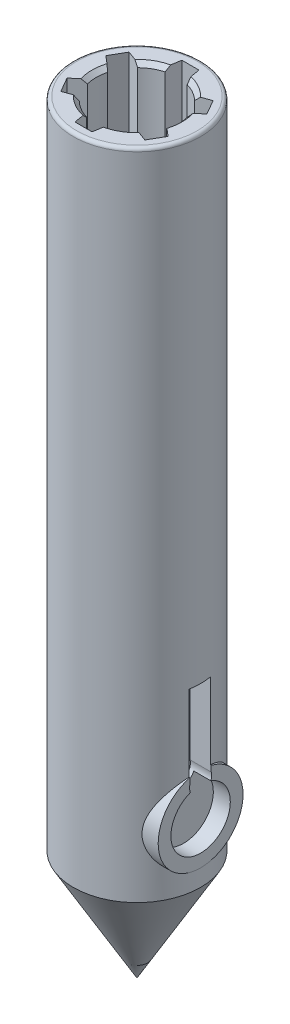
from build123d import *

# Parameters (mm, degrees)
BOSS_EXTRUDE1_REACH = 81.121
SENSOR_R            = 6.35
CHAMFER1_SIZE       = 0.635
FILLET3_R           = 0.508
SKETCH4_R           = 4.445
CUT_EXTRUDE1_DEPTH  = 2.54
CUT_EXTRUDE2_DEPTH  = 3.175
CUT_EXTRUDE8_REACH  = 117.091
CIRPATTERN1_COUNT   = 6


with BuildPart() as part:
    # Sketch1 → mainBody (revolve)
    with BuildSketch(Plane(origin=(0, 0, 0), x_dir=(0, 0, -1), z_dir=(1, 0, 0)), mode=Mode.PRIVATE) as mainbody_sk:
        Polygon((-6.096, 38.1), (-6.096, 8.705990249), (0, 0), (0, -76.2), (-9.525, -59.702216058), (-9.525, 38.1), align=None)
    revolve(mainbody_sk.sketch.rotate(Axis((0, 0, 0), (0, 1, 0)), 180), axis=Axis((0, 0, 0), (0, 1, 0)))

    # sensor → Boss-Extrude1 (add, up to next)
    with BuildSketch(Plane(origin=(9.525, 0, 0), x_dir=(0, 0, -1), z_dir=(1, 0, 0)), mode=Mode.PRIVATE) as boss_extrude1_sk1:
        with Locations((0, -50.812216058)):
            Circle(SENSOR_R)
    boss_extrude1_tool1 = extrude(boss_extrude1_sk1.sketch, amount=-BOSS_EXTRUDE1_REACH, mode=Mode.PRIVATE) - part.part
    add(boss_extrude1_tool1.solids().sort_by_distance((9.525, -50.812216, 0))[0])
    add(boss_extrude1_tool1.solids().sort_by_distance((9.525, -50.812216, 0))[1])

    # Chamfer1
    chamfer1_edges = [part.edges().sort_by_distance(p)[0] for p in [
        (0, 38.1, 6.096),
    ]]
    chamfer(chamfer1_edges, length=CHAMFER1_SIZE)

    # Fillet3
    fillet3_edges = [part.edges().sort_by_distance(p)[0] for p in [
        (0, 38.1, 9.525),
    ]]
    fillet(fillet3_edges, radius=FILLET3_R)

    # Sketch4 → Cut-Extrude1 (cut)
    with BuildSketch(Plane(origin=(9.525, 0, 0), x_dir=(0, 0, -1), z_dir=(1, 0, 0))):
        with Locations((0, -50.812216058)):
            Circle(SKETCH4_R)
    extrude(amount=-CUT_EXTRUDE1_DEPTH, mode=Mode.SUBTRACT)

    # Sketch5 → Cut-Extrude2 (cut)
    with BuildSketch(Plane(origin=(9.525, 0, 0), x_dir=(0, 0, -1), z_dir=(1, 0, 0))):
        with BuildLine():
            Line((-1.5875, -33.286216058), (1.5875, -33.286216058))
            Line((1.5875, -33.286216058), (1.5875, -45.532735353))
            ThreePointArc((1.5875, -45.532735353), (0, -47.637216058), (-1.5875, -45.532735353))
            Line((-1.5875, -45.532735353), (-1.5875, -33.286216058))
        make_face()
    extrude(amount=-CUT_EXTRUDE2_DEPTH, mode=Mode.SUBTRACT)

    # Cut-Extrude8: up to this cone (the profile starts inside it)
    cut_extrude8_end = Plane(origin=(0, 38.1, 0), z_dir=(0, 1, 0)).offset(-38.099999) * Cone(1e-06, 127.696083561, 182.368906206, align=(Align.CENTER, Align.CENTER, Align.MIN), mode=Mode.PRIVATE)
    # Sketch13 → Cut-Extrude8 (cut, up to the surface)
    with BuildSketch(Plane(origin=(0, 38.1, 0), x_dir=(1, 0, 0), z_dir=(0, 1, 0)), mode=Mode.PRIVATE) as cut_extrude8_sk1:
        Polygon((-1.27, 8.001), (1.27, 8.001), (2.27589157, 2.296305428), (-2.27589157, 2.296305428), align=None)
    cut_extrude8_tool1 = extrude(cut_extrude8_sk1.sketch, amount=-CUT_EXTRUDE8_REACH, mode=Mode.PRIVATE) & cut_extrude8_end
    cut_extrude8 = cut_extrude8_tool1.solids().sort_by_distance((0, 38.1, -4.878937))[0]
    add(cut_extrude8, mode=Mode.SUBTRACT)

    # CirPattern1: Cut-Extrude8 ×6 about axis
    cirpattern1_axis = Axis((0, 0, 0), (0, 1, 0))
    for i in range(1, CIRPATTERN1_COUNT):
        add(cut_extrude8.rotate(cirpattern1_axis, i * 360 / CIRPATTERN1_COUNT), mode=Mode.SUBTRACT)

    # Sketch14 → Cut-Revolve4 (revolve, cut)
    with BuildSketch(Plane.XY, mode=Mode.PRIVATE) as cut_revolve4_sk:
        Polygon((0, -3.81), (7.9375, -3.81), (7.9375, -19.6977), (3.175, -19.6977), (3.175, -22.7457), (7.9375, -22.7457), (7.9375, -32.2707), (0, -32.2707), align=None)
    revolve(cut_revolve4_sk.sketch.rotate(Axis((0, 0, 0), (0, 1, 0)), 90), axis=Axis((0, 0, 0), (0, 1, 0)), mode=Mode.SUBTRACT)


solid = part.part
